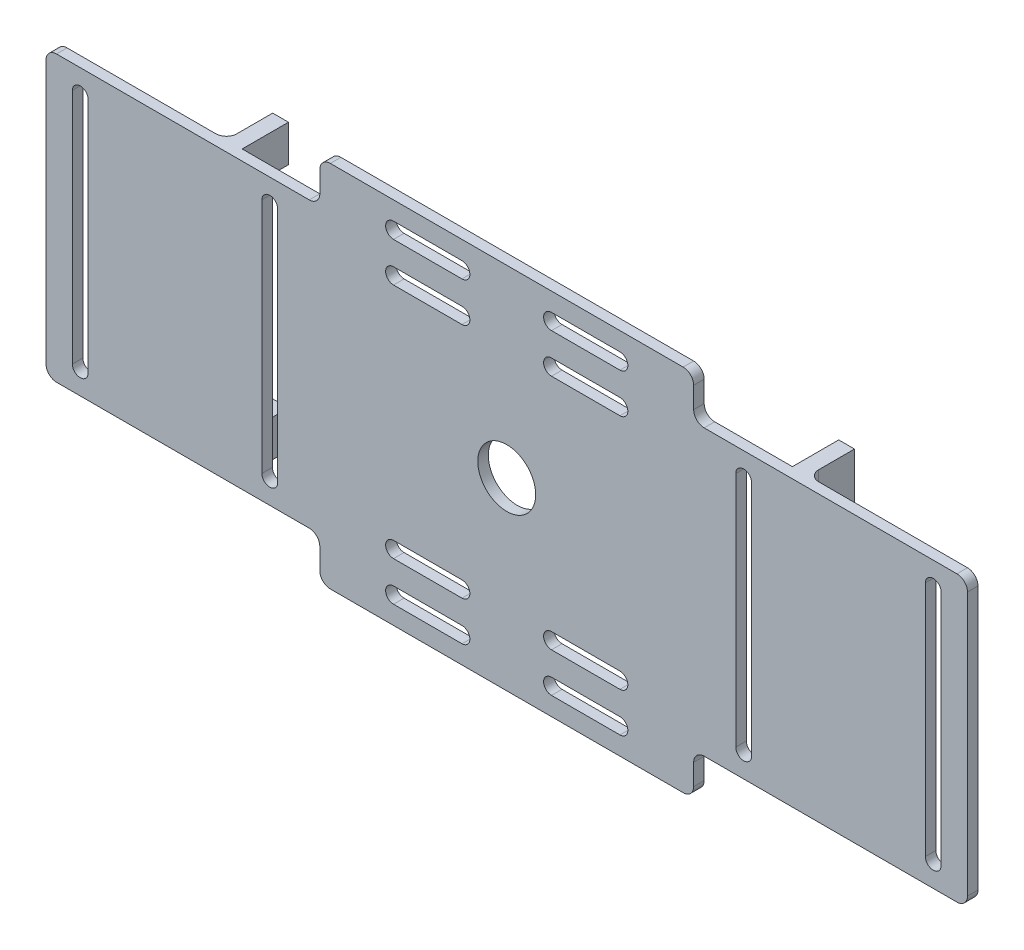
from build123d import *

# Parameters (mm, degrees)
EXTRUDE_1_DEPTH     = 2
SKETCH_2_R          = 5.5
CUT_EXTRUDE_1_DEPTH = 95.26160406
SKETCH_5_W          = 3
SKETCH_5_H          = 54
EXTRUDE_2_DEPTH     = 10.8
FILLET_1_R          = 2
SKETCH_6_W          = 3
SKETCH_6_H          = 40
CUT_EXTRUDE_3_DEPTH = 6
FILLET_2_R          = 2
FILLET_3_R          = 2


with BuildPart() as part:
    # 草圖1 → 填料-伸長1 (new body)
    with BuildSketch(Plane.XY):
        with BuildLine():
            Line((35.5, 33), (35.5, 29))
            ThreePointArc((35.5, 29), (36.085786438, 27.585786438), (37.5, 27))
            Line((37.5, 27), (85.5, 27))
            ThreePointArc((85.5, 27), (86.914213562, 26.414213562), (87.5, 25))
            Line((87.5, 25), (87.5, -25))
            ThreePointArc((87.5, -25), (86.914213562, -26.414213562), (85.5, -27))
            Line((85.5, -27), (37.5, -27))
            ThreePointArc((37.5, -27), (36.085786438, -27.585786438), (35.5, -29))
            Line((35.5, -29), (35.5, -33))
            ThreePointArc((35.5, -33), (34.914213562, -34.414213562), (33.5, -35))
            Line((33.5, -35), (-33.5, -35))
            ThreePointArc((-33.5, -35), (-34.914213562, -34.414213562), (-35.5, -33))
            Line((-35.5, -33), (-35.5, -29))
            ThreePointArc((-35.5, -29), (-36.085786438, -27.585786438), (-37.5, -27))
            Line((-37.5, -27), (-85.5, -27))
            ThreePointArc((-85.5, -27), (-86.914213562, -26.414213562), (-87.5, -25))
            Line((-87.5, -25), (-87.5, 25))
            ThreePointArc((-87.5, 25), (-86.914213562, 26.414213562), (-85.5, 27))
            Line((-85.5, 27), (-37.5, 27))
            ThreePointArc((-37.5, 27), (-36.085786438, 27.585786438), (-35.5, 29))
            Line((-35.5, 29), (-35.5, 33))
            ThreePointArc((-35.5, 33), (-34.914213562, 34.414213562), (-33.5, 35))
            Line((-33.5, 35), (33.5, 35))
            ThreePointArc((33.5, 35), (34.914213562, 34.414213562), (35.5, 33))
        make_face()
    extrude(amount=EXTRUDE_1_DEPTH)

    # 草圖2 → 除料-伸長1 (cut, through all)
    with BuildSketch(Plane.XY.offset(2)):
        Circle(SKETCH_2_R)
        with BuildLine():
            Line((43.5, -22.5), (43.5, 22.5))
            ThreePointArc((43.5, 22.5), (45, 24), (46.5, 22.5))
            Line((46.5, 22.5), (46.5, -22.5))
            ThreePointArc((46.5, -22.5), (45, -24), (43.5, -22.5))
        make_face()
        with BuildLine():
            Line((-46.5, -22.5), (-46.5, 22.5))
            ThreePointArc((-46.5, 22.5), (-45, 24), (-43.5, 22.5))
            Line((-43.5, 22.5), (-43.5, -22.5))
            ThreePointArc((-43.5, -22.5), (-45, -24), (-46.5, -22.5))
        make_face()
        with BuildLine():
            Line((21.5, 28.5), (8.5, 28.5))
            ThreePointArc((8.5, 28.5), (7, 30), (8.5, 31.5))
            Line((8.5, 31.5), (21.5, 31.5))
            ThreePointArc((21.5, 31.5), (23, 30), (21.5, 28.5))
        make_face()
        with BuildLine():
            Line((-82.5, -22.5), (-82.5, 22.5))
            ThreePointArc((-82.5, 22.5), (-81, 24), (-79.5, 22.5))
            Line((-79.5, 22.5), (-79.5, -22.5))
            ThreePointArc((-79.5, -22.5), (-81, -24), (-82.5, -22.5))
        make_face()
        with BuildLine():
            Line((79.5, -22.5), (79.5, 22.5))
            ThreePointArc((79.5, 22.5), (81, 24), (82.5, 22.5))
            Line((82.5, 22.5), (82.5, -22.5))
            ThreePointArc((82.5, -22.5), (81, -24), (79.5, -22.5))
        make_face()
        with BuildLine():
            Line((21.5, 21), (8.5, 21))
            ThreePointArc((8.5, 21), (7, 22.5), (8.5, 24))
            Line((8.5, 24), (21.5, 24))
            ThreePointArc((21.5, 24), (23, 22.5), (21.5, 21))
        make_face()
        with BuildLine():
            Line((-21.5, 28.5), (-8.5, 28.5))
            ThreePointArc((-8.5, 28.5), (-7, 30), (-8.5, 31.5))
            Line((-8.5, 31.5), (-21.5, 31.5))
            ThreePointArc((-21.5, 31.5), (-23, 30), (-21.5, 28.5))
        make_face()
        with BuildLine():
            Line((-21.5, 21), (-8.5, 21))
            ThreePointArc((-8.5, 21), (-7, 22.5), (-8.5, 24))
            Line((-8.5, 24), (-21.5, 24))
            ThreePointArc((-21.5, 24), (-23, 22.5), (-21.5, 21))
        make_face()
        with BuildLine():
            Line((21.5, -28.5), (8.5, -28.5))
            ThreePointArc((8.5, -28.5), (7, -30), (8.5, -31.5))
            Line((8.5, -31.5), (21.5, -31.5))
            ThreePointArc((21.5, -31.5), (23, -30), (21.5, -28.5))
        make_face()
        with BuildLine():
            Line((21.5, -21), (8.5, -21))
            ThreePointArc((8.5, -21), (7, -22.5), (8.5, -24))
            Line((8.5, -24), (21.5, -24))
            ThreePointArc((21.5, -24), (23, -22.5), (21.5, -21))
        make_face()
        with BuildLine():
            Line((-21.5, -28.5), (-8.5, -28.5))
            ThreePointArc((-8.5, -28.5), (-7, -30), (-8.5, -31.5))
            Line((-8.5, -31.5), (-21.5, -31.5))
            ThreePointArc((-21.5, -31.5), (-23, -30), (-21.5, -28.5))
        make_face()
        with BuildLine():
            Line((-21.5, -21), (-8.5, -21))
            ThreePointArc((-8.5, -21), (-7, -22.5), (-8.5, -24))
            Line((-8.5, -24), (-21.5, -24))
            ThreePointArc((-21.5, -24), (-23, -22.5), (-21.5, -21))
        make_face()
    extrude(amount=-CUT_EXTRUDE_1_DEPTH, mode=Mode.SUBTRACT)

    # 草圖5 → 填料-伸長2 (add)
    with BuildSketch(Plane.XY.offset(2)):
        with Locations((-53.75, 0)):
            Rectangle(SKETCH_5_W, SKETCH_5_H)
        with Locations((53.75, 0)):
            Rectangle(SKETCH_5_W, SKETCH_5_H)
    extrude(amount=-EXTRUDE_2_DEPTH)

    # 圓角1
    fillet_1_edges = [part.edges().sort_by_distance(p)[0] for p in [
        (55.25, 0, 0),
    ]]
    fillet(fillet_1_edges, radius=FILLET_1_R)

    # 草圖6 → 除料-伸長3 (cut)
    with BuildSketch(Plane(origin=(0, 0, -8.8), x_dir=(-1, 0, 0), z_dir=(0, 0, -1))):
        with Locations((53.75, 0)):
            Rectangle(SKETCH_6_W, SKETCH_6_H)
    extrude(amount=-CUT_EXTRUDE_3_DEPTH, mode=Mode.SUBTRACT)

    # 圓角2
    fillet_2_edges = [part.edges().sort_by_distance(p)[0] for p in [
        (-53.75, -20, -2.8),
        (-53.75, 20, -2.8),
    ]]
    fillet(fillet_2_edges, radius=FILLET_2_R)

    # 圓角3
    fillet_3_edges = [part.edges().sort_by_distance(p)[0] for p in [
        (-55.25, 0, 0),
    ]]
    fillet(fillet_3_edges, radius=FILLET_3_R)


solid = part.part
